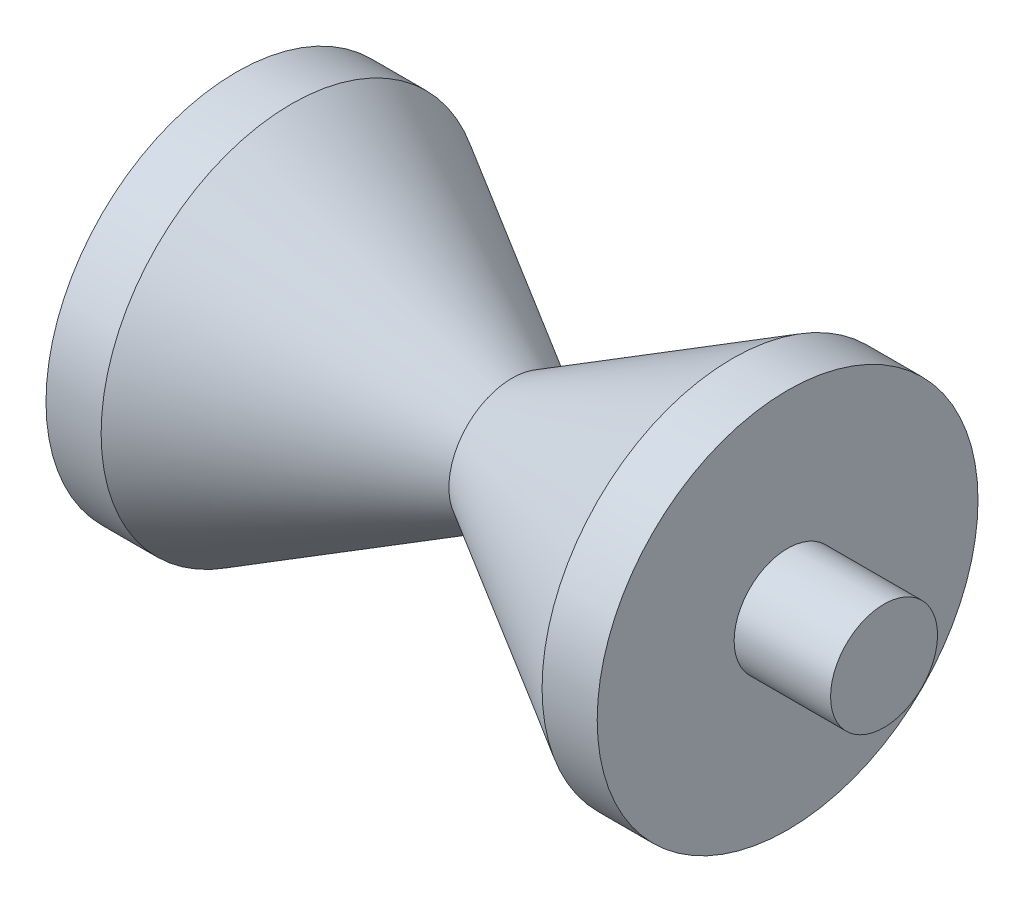
from build123d import *

# Parameters (mm, degrees)
SKETCH1_W   = 1
SKETCH1_H   = 3.454401077
SKETCH1_W_2 = 1.75
SKETCH1_H_2 = 0.97


with BuildPart() as part:
    # Sketch1 → Revolve1 (revolve)
    with BuildSketch(Plane.XY, mode=Mode.PRIVATE) as revolve1_sk:
        Polygon((0, 0), (0, 1.145), (4, 3.454401077), (4, 0), align=None)
        with Locations((4.5, 1.727200539)):
            Rectangle(SKETCH1_W, SKETCH1_H)
        with Locations((5.875, 0.485)):
            Rectangle(SKETCH1_W_2, SKETCH1_H_2)
    revolve1 = revolve(revolve1_sk.sketch.rotate(Axis((0, 0, 0), (1, 0, 0)), 90), axis=Axis((0, 0, 0), (1, 0, 0)))

    # Mirror1: Revolve1 across plane
    add(revolve1.mirror(Plane(origin=(0, 0, 0), x_dir=(0, 0, 1), z_dir=(1, 0, 0))))


solid = part.part
